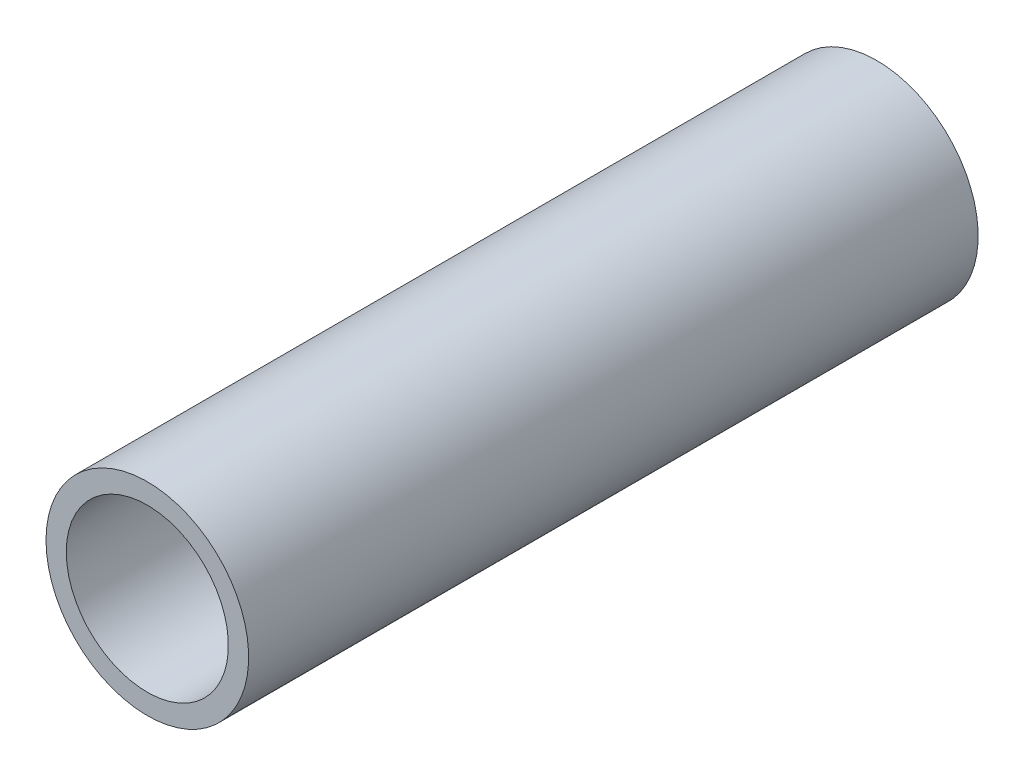
from build123d import *

# Parameters (mm, degrees)
ESBO_O1_R                = 12.5
ESBO_O1_R_2              = 10
RESSALTO_EXTRUS_O1_DEPTH = 90


with BuildPart() as part:
    # Esboço1 → Ressalto-extrusão1 (new body)
    with BuildSketch(Plane.XY):
        with Locations(Location((0, 0, 0), (0, 0, 180))):
            Circle(ESBO_O1_R)
        with Locations(Location((0, 0, 0), (0, 0, 180))):
            Circle(ESBO_O1_R_2, mode=Mode.SUBTRACT)
    extrude(amount=RESSALTO_EXTRUS_O1_DEPTH)


solid = part.part
